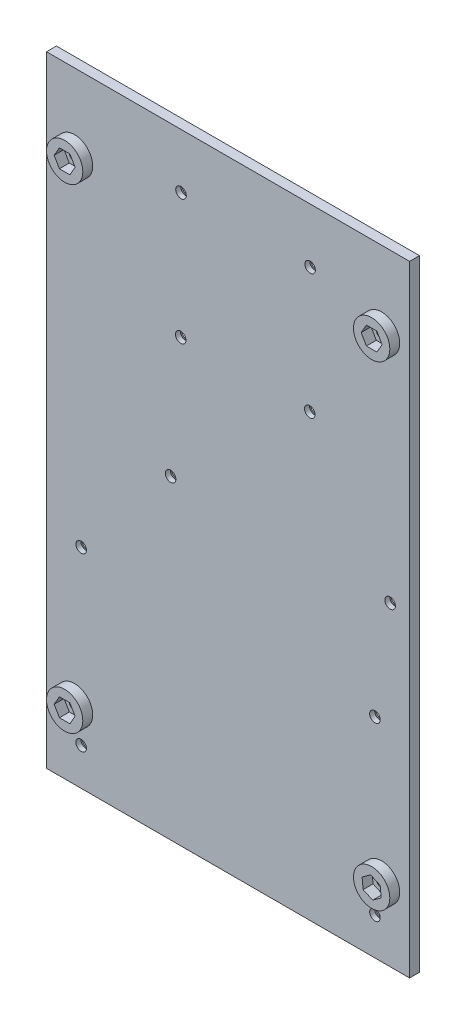
from build123d import *

# Parameters (mm, degrees)
SKETCH_1_W          = 110
SKETCH_1_H          = 188
EXTRUDE_1_DEPTH     = 3
SKETCH_2_R          = 1.6
CUT_EXTRUDE_1_DEPTH = 109.9495296
SKETCH_3_R          = 1.6
CUT_EXTRUDE_2_DEPTH = 109.9495296
CHAMFER_1_SIZE      = 1.5
SKETCH_4_R          = 5.5
EXTRUDE_2_DEPTH     = 3
CUT_EXTRUDE_3_DEPTH = 3


with BuildPart() as part:
    # 草图1 → 凸台-拉伸1 (new body)
    with BuildSketch(Plane.XY):
        Rectangle(SKETCH_1_W, SKETCH_1_H)
    extrude(amount=EXTRUDE_1_DEPTH)

    # 草图2 → 切除-拉伸1 (cut, through all)
    with BuildSketch(Plane.XY.offset(3)):
        with Locations((-46.5, 71)):
            Circle(SKETCH_2_R)
        with Locations((46.5, 71)):
            Circle(SKETCH_2_R)
        with Locations((-46.5, -73)):
            Circle(SKETCH_2_R)
        with Locations((46.5, -73)):
            Circle(SKETCH_2_R)
    extrude(amount=-CUT_EXTRUDE_1_DEPTH, mode=Mode.SUBTRACT)

    # 草图3 → 切除-拉伸2 (cut, through all)
    with BuildSketch(Plane.XY.offset(3)):
        with Locations((-44.5, -30.712116859)):
            Circle(SKETCH_3_R)
        with Locations((44.5, -30.712116859)):
            Circle(SKETCH_3_R)
        with Locations((44.5, -82.712116859)):
            Circle(SKETCH_3_R)
        with Locations((-44.5, -82.712116859)):
            Circle(SKETCH_3_R)
        with Locations((24.853547672, 77.430870452)):
            Circle(SKETCH_3_R)
        with Locations((-14.246452328, 77.430870452)):
            Circle(SKETCH_3_R)
        with Locations((24.761490923, 39.430870452)):
            Circle(SKETCH_3_R)
        with Locations((-14.338509077, 39.430870452)):
            Circle(SKETCH_3_R)
        with Locations((49.103547672, 1.430870452)):
            Circle(SKETCH_3_R)
        with Locations((-17.396452328, 1.430870452)):
            Circle(SKETCH_3_R)
    extrude(amount=-CUT_EXTRUDE_2_DEPTH, mode=Mode.SUBTRACT)

    # Chamfer 1
    chamfer_1_edges = [part.edges().sort_by_distance(p)[0] for p in [
        (-15.846452328, 77.430870452, 0),
        (23.161490923, 39.430870452, 0),
        (-15.938509077, 39.430870452, 0),
        (47.503547672, 1.430870452, 0),
        (23.253547672, 77.430870452, 0),
        (-46.1, -82.712116859, 0),
        (42.9, -82.712116859, 0),
        (42.9, -30.712116859, 0),
        (-18.996452328, 1.430870452, 0),
        (-46.1, -30.712116859, 0),
    ]]
    chamfer(chamfer_1_edges, length=CHAMFER_1_SIZE)

    # 草图4 → 凸台-拉伸2 (add)
    with BuildSketch(Plane.XY.offset(3)):
        with Locations((-46.5, 71)):
            Circle(SKETCH_4_R)
        with Locations((46.5, 71)):
            Circle(SKETCH_4_R)
        with Locations((-46.5, -73)):
            Circle(SKETCH_4_R)
        with Locations((46.5, -73)):
            Circle(SKETCH_4_R)
    extrude(amount=EXTRUDE_2_DEPTH)

    # 草图5 → 切除-拉伸3 (cut)
    with BuildSketch(Plane.XY.offset(6)):
        Polygon((-43.324573519, 71), (-44.91228676, 73.75), (-48.08771324, 73.75), (-49.675426481, 71), (-48.08771324, 68.25), (-44.91228676, 68.25), align=None)
        Polygon((49.675426481, 71), (48.08771324, 73.75), (44.91228676, 73.75), (43.324573519, 71), (44.91228676, 68.25), (48.08771324, 68.25), align=None)
        Polygon((-44.89847641, -75.741980219), (-43.324613678, -72.984029996), (-44.926137269, -70.242049776), (-48.10152359, -70.258019781), (-49.675386322, -73.015970004), (-48.073862731, -75.757950224), align=None)
        Polygon((46.813998882, -76.15986361), (49.3935216, -74.308000796), (49.079522718, -71.148137186), (46.186001118, -69.84013639), (43.6064784, -71.691999204), (43.920477282, -74.851862814), align=None)
    extrude(amount=-CUT_EXTRUDE_3_DEPTH, mode=Mode.SUBTRACT)


solid = part.part
